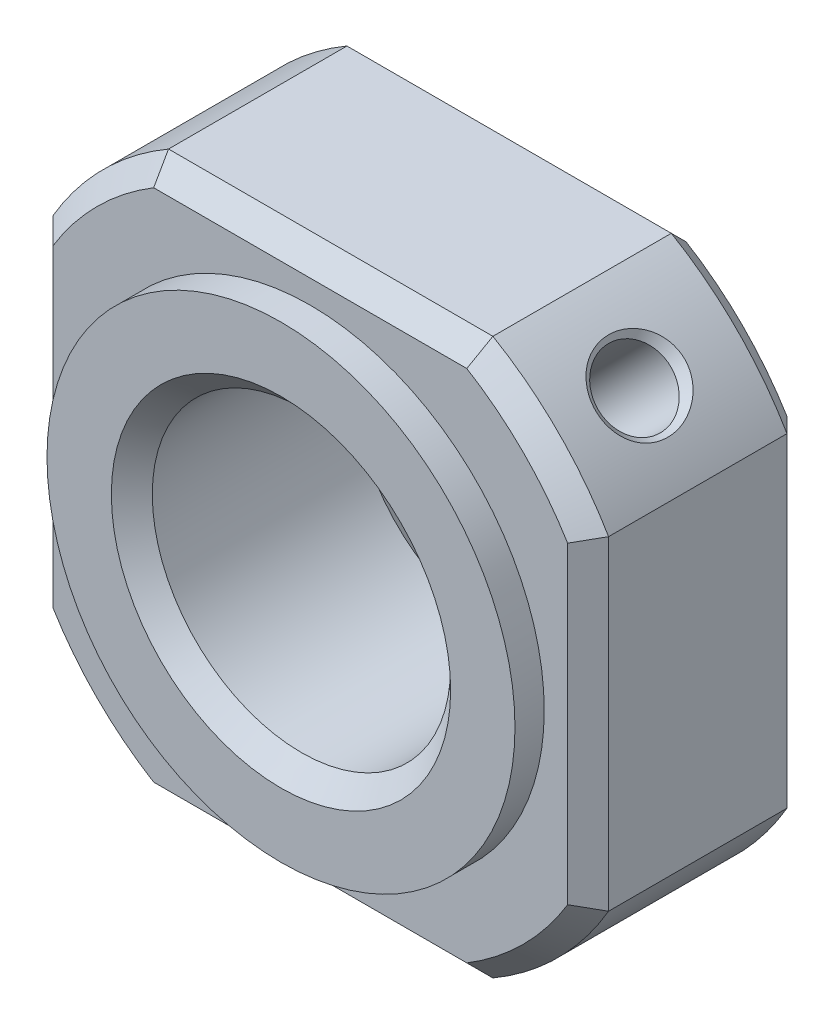
from build123d import *

# Parameters (mm, degrees)
BOSS_EXTRUDE1_DEPTH          = 8.5
SKETCH2_OUTSIDE_W            = 26.636
SKETCH2_OUTSIDE_H            = 26.636
SKETCH2_OUTSIDE_R            = 8
CUT_EXTRUDE1_DEPTH           = 1
CHAMFER2_SIZE                = 0.7
M12_TAPPED_HOLE1_D           = 10.2
M12_TAPPED_HOLE1_DEPTH       = 10
M12_TAPPED_HOLE1_CSINK_D     = 12.05
M12_TAPPED_HOLE1_CSINK_ANGLE = 90
M12_TAPPED_HOLE1_TIP         = 3.064389157
CHAMFER3_SIZE                = 0.7
M3_TAPPED_HOLE5_D            = 2.5
M3_TAPPED_HOLE5_DEPTH        = 7.5
M3_TAPPED_HOLE5_CSINK_D      = 3.05
M3_TAPPED_HOLE5_CSINK_ANGLE  = 90
M3_TAPPED_HOLE5_TIP          = 0.751075774


with BuildPart() as part:
    # Sketch1 → Boss-Extrude1 (new body)
    with BuildSketch(Plane.XY):
        with BuildLine():
            Line((-9.5, 5.545268253), (-9.5, -5.545268253))
            ThreePointArc((-9.5, -5.545268253), (-7.778174593, -7.778174593), (-5.545268253, -9.5))
            Line((-5.545268253, -9.5), (5.545268253, -9.5))
            ThreePointArc((5.545268253, -9.5), (7.778174593, -7.778174593), (9.5, -5.545268253))
            Line((9.5, -5.545268253), (9.5, 5.545268253))
            ThreePointArc((9.5, 5.545268253), (7.778174593, 7.778174593), (5.545268253, 9.5))
            Line((5.545268253, 9.5), (-5.545268253, 9.5))
            ThreePointArc((-5.545268253, 9.5), (-7.778174593, 7.778174593), (-9.5, 5.545268253))
        make_face()
    extrude(amount=-BOSS_EXTRUDE1_DEPTH)

    # Sketch2 outside → Cut-Extrude1 (cut)
    with BuildSketch(Plane.XY):
        Rectangle(SKETCH2_OUTSIDE_W, SKETCH2_OUTSIDE_H)
        Circle(SKETCH2_OUTSIDE_R, mode=Mode.SUBTRACT)
    extrude(amount=-CUT_EXTRUDE1_DEPTH, mode=Mode.SUBTRACT)

    # Chamfer2
    chamfer2_edges = [part.edges().sort_by_distance(p)[0] for p in [
        (0, 9.5, -8.5),
        (-7.778174593, 7.778174593, -8.5),
        (-9.5, 0, -8.5),
        (-7.778174593, -7.778174593, -8.5),
        (0, -9.5, -8.5),
        (7.778174593, -7.778174593, -8.5),
        (9.5, 0, -8.5),
        (7.778174593, 7.778174593, -8.5),
        (0, -9.5, -1),
        (-7.778174593, -7.778174593, -1),
        (-9.5, 0, -1),
        (7.778174593, -7.778174593, -1),
        (9.5, 0, -1),
        (7.778174593, 7.778174593, -1),
        (0, 9.5, -1),
        (-7.778174593, 7.778174593, -1),
    ]]
    chamfer(chamfer2_edges, length=CHAMFER2_SIZE)

    # M12 Tapped Hole1
    with Locations(Plane(origin=(0, 0, -8.5), x_dir=(-1, 0, 0), z_dir=(0, 0, -1))):
        with Locations((0, 0)):
            CounterSinkHole(M12_TAPPED_HOLE1_D / 2, M12_TAPPED_HOLE1_CSINK_D / 2, depth=M12_TAPPED_HOLE1_DEPTH, counter_sink_angle=M12_TAPPED_HOLE1_CSINK_ANGLE)
            with Locations((0, 0, -(M12_TAPPED_HOLE1_DEPTH + M12_TAPPED_HOLE1_TIP / 2))):  # 118° drill point
                Cone(0, M12_TAPPED_HOLE1_D / 2, M12_TAPPED_HOLE1_TIP, mode=Mode.SUBTRACT)

    # Chamfer3
    chamfer3_edges = [part.edges().sort_by_distance(p)[0] for p in [
        (-5.1, 0, 0),
    ]]
    chamfer(chamfer3_edges, length=CHAMFER3_SIZE)

    # M3 Tapped Hole5
    with Locations(Plane(origin=(7.778174593, 7.778174593, -4.5), x_dir=(-0.707106781187, 0.707106781187, 0), z_dir=(0.707106781187, 0.707106781187, 0))):
        with Locations((0, 0)):
            CounterSinkHole(M3_TAPPED_HOLE5_D / 2, M3_TAPPED_HOLE5_CSINK_D / 2, depth=M3_TAPPED_HOLE5_DEPTH, counter_sink_angle=M3_TAPPED_HOLE5_CSINK_ANGLE)
            with Locations((0, 0, -(M3_TAPPED_HOLE5_DEPTH + M3_TAPPED_HOLE5_TIP / 2))):  # 118° drill point
                Cone(0, M3_TAPPED_HOLE5_D / 2, M3_TAPPED_HOLE5_TIP, mode=Mode.SUBTRACT)


solid = part.part
